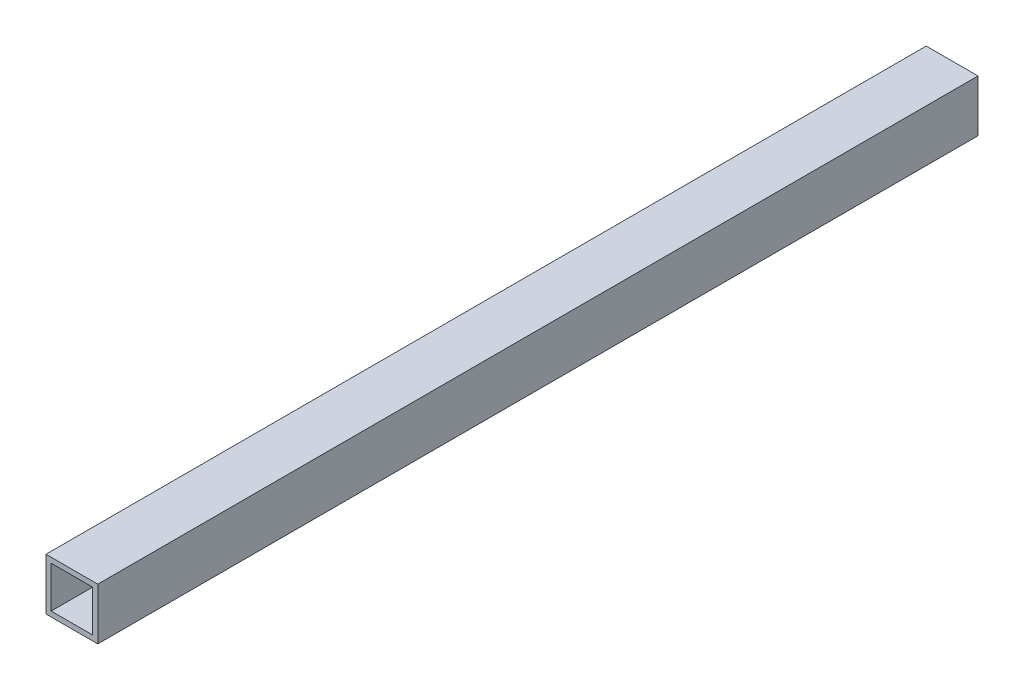
from build123d import *

# Parameters (mm, degrees)
SKETCH_1_W      = 20
SKETCH_1_H      = 20
SKETCH_1_W_2    = 16
SKETCH_1_H_2    = 16
EXTRUDE_1_DEPTH = 340


with BuildPart() as part:
    # 草图1 → 凸台-拉伸1 (new body)
    with BuildSketch(Plane.XY):
        Rectangle(SKETCH_1_W, SKETCH_1_H)
        Rectangle(SKETCH_1_W_2, SKETCH_1_H_2, mode=Mode.SUBTRACT)
    extrude(amount=EXTRUDE_1_DEPTH)


solid = part.part
